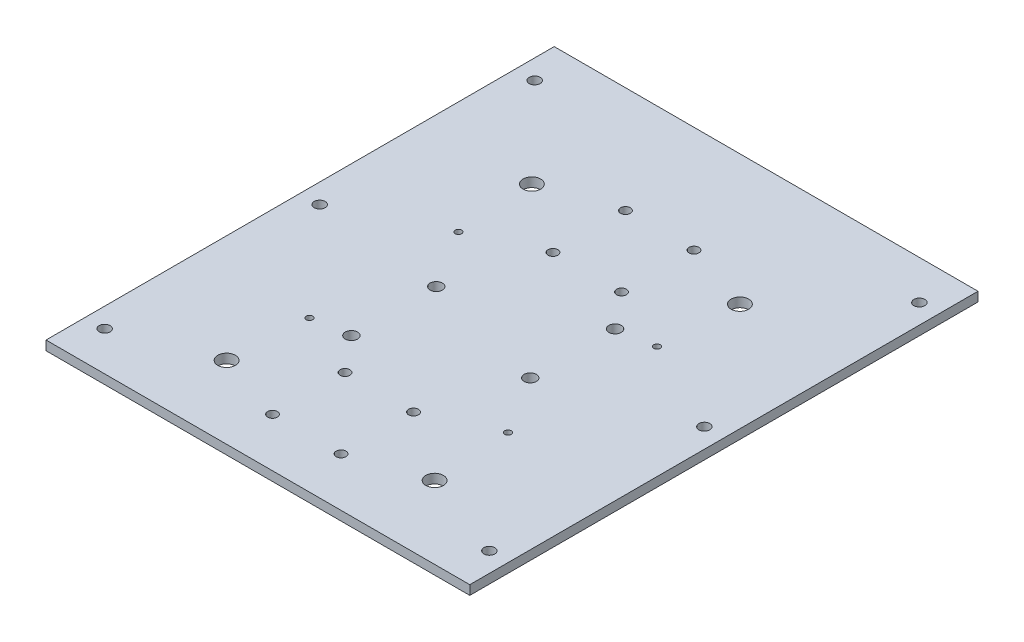
from build123d import *

# Parameters (mm, degrees)
SKETCH1_W           = 216.8
SKETCH1_H           = 260
SKETCH1_R           = 3.15
SKETCH1_R_2         = 2.5
SKETCH1_R_3         = 4.5
SKETCH1_R_4         = 2.8
SKETCH1_R_5         = 1.65
BOSS_EXTRUDE1_DEPTH = 4.7625


with BuildPart() as part:
    # Sketch1 → Boss-Extrude1 (new body)
    with BuildSketch(Plane(origin=(0, 0, 0), x_dir=(1, 0, 0), z_dir=(0, 1, 0))):
        with Locations((32.25, 49.916)):
            Rectangle(SKETCH1_W, SKETCH1_H)
        with Locations(Location((0, 0, 0), (0, 0, 90))):
            Circle(SKETCH1_R, mode=Mode.SUBTRACT)
        with Locations(Location((64.5, 27, 0), (0, 0, 90))):
            Circle(SKETCH1_R, mode=Mode.SUBTRACT)
        with Locations(Location((0, 43.4, 0), (0, 0, 90))):
            Circle(SKETCH1_R, mode=Mode.SUBTRACT)
        with Locations(Location((64.5, 70.4, 0), (0, 0, 90))):
            Circle(SKETCH1_R, mode=Mode.SUBTRACT)
        with Locations(Location((14.724, 125.484, 0), (0, 0, 90))):
            Circle(SKETCH1_R_2, mode=Mode.SUBTRACT)
        with Locations(Location((49.776, 125.484, 0), (0, 0, 90))):
            Circle(SKETCH1_R_2, mode=Mode.SUBTRACT)
        with Locations(Location((14.724, 88.4, 0), (0, 0, 90))):
            Circle(SKETCH1_R_2, mode=Mode.SUBTRACT)
        with Locations(Location((49.776, 88.4, 0), (0, 0, 90))):
            Circle(SKETCH1_R_2, mode=Mode.SUBTRACT)
        with Locations(Location((-20.963, 113.292, 0), (0, 0, 90))):
            Circle(SKETCH1_R_3, mode=Mode.SUBTRACT)
        with Locations(Location((85.463, 113.292, 0), (0, 0, 90))):
            Circle(SKETCH1_R_3, mode=Mode.SUBTRACT)
        with Locations(Location((14.724, -18, 0), (0, 0, 90))):
            Circle(SKETCH1_R_2, mode=Mode.SUBTRACT)
        with Locations(Location((49.776, -18, 0), (0, 0, 90))):
            Circle(SKETCH1_R_2, mode=Mode.SUBTRACT)
        with Locations(Location((14.724, -55.084, 0), (0, 0, 90))):
            Circle(SKETCH1_R_2, mode=Mode.SUBTRACT)
        with Locations(Location((49.776, -55.084, 0), (0, 0, 90))):
            Circle(SKETCH1_R_2, mode=Mode.SUBTRACT)
        with Locations(Location((-20.963, -42.892, 0), (0, 0, 90))):
            Circle(SKETCH1_R_3, mode=Mode.SUBTRACT)
        with Locations(Location((85.463, -42.892, 0), (0, 0, 90))):
            Circle(SKETCH1_R_3, mode=Mode.SUBTRACT)
        with Locations(Location((-66.15, 159.916, 0), (0, 0, 90))):
            Circle(SKETCH1_R_4, mode=Mode.SUBTRACT)
        with Locations(Location((-66.15, 49.916, 0), (0, 0, 90))):
            Circle(SKETCH1_R_4, mode=Mode.SUBTRACT)
        with Locations(Location((-66.15, -60.084, 0), (0, 0, 90))):
            Circle(SKETCH1_R_4, mode=Mode.SUBTRACT)
        with Locations(Location((130.65, -60.084, 0), (0, 0, 90))):
            Circle(SKETCH1_R_4, mode=Mode.SUBTRACT)
        with Locations(Location((130.65, 49.916, 0), (0, 0, 90))):
            Circle(SKETCH1_R_4, mode=Mode.SUBTRACT)
        with Locations(Location((130.65, 159.916, 0), (0, 0, 90))):
            Circle(SKETCH1_R_4, mode=Mode.SUBTRACT)
        with Locations(Location((-18.55, 73.3, 0), (0, 0, 90))):
            Circle(SKETCH1_R_5, mode=Mode.SUBTRACT)
        with Locations(Location((83.05, 73.3, 0), (0, 0, 90))):
            Circle(SKETCH1_R_5, mode=Mode.SUBTRACT)
        with Locations(Location((-18.55, -2.9, 0), (0, 0, 90))):
            Circle(SKETCH1_R_5, mode=Mode.SUBTRACT)
        with Locations(Location((83.05, -2.9, 0), (0, 0, 90))):
            Circle(SKETCH1_R_5, mode=Mode.SUBTRACT)
    extrude(amount=BOSS_EXTRUDE1_DEPTH)


solid = part.part
